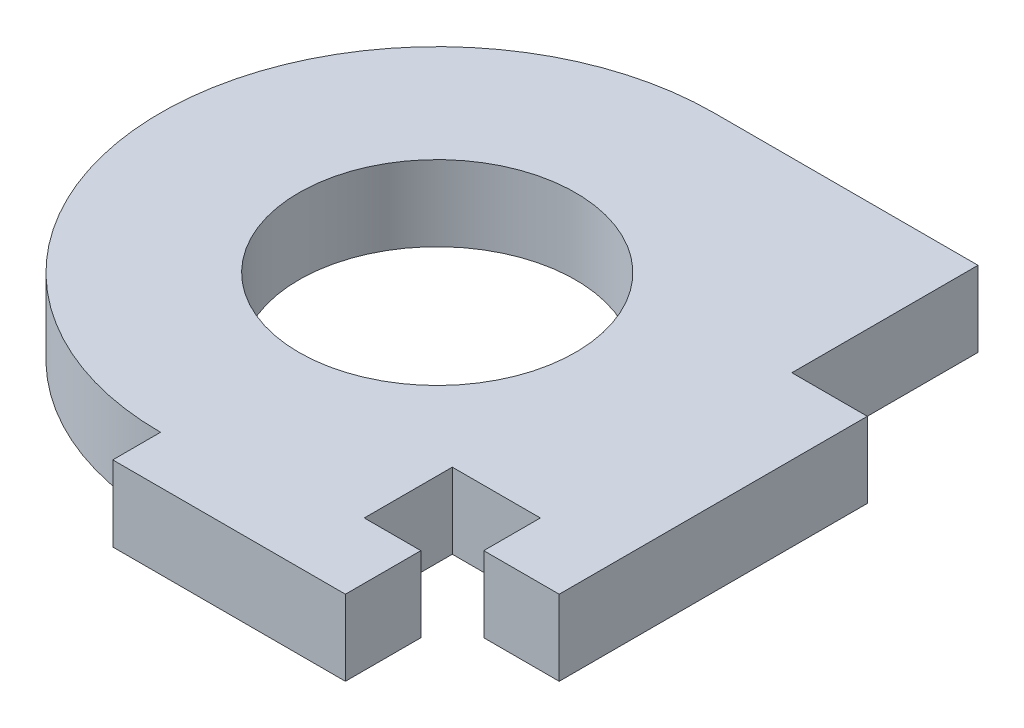
from build123d import *

# Parameters (mm, degrees)
SKETCH1_R           = 11
BOSS_EXTRUDE1_DEPTH = 6


with BuildPart() as part:
    # Sketch1 → Boss-Extrude1 (new body)
    with BuildSketch(Plane(origin=(0, 0, 0), x_dir=(1, 0, 0), z_dir=(0, 1, 0))):
        with BuildLine():
            Line((0, 0), (0, 7))
            Line((0, 7), (7, 7))
            Line((7, 7), (7, 2.5))
            Line((7, 2.5), (13, 2.5))
            Line((13, 2.5), (13, 27))
            Line((13, 27), (7, 27))
            Line((7, 27), (7, 41.8))
            Line((7, 41.8), (-14, 41.8))
            ThreePointArc((-14, 41.8), (-36, 19.8), (-14, -2.2))
            Line((-14, -2.2), (-14, -6))
            Line((-14, -6), (4.5, -6))
            Line((4.5, -6), (4.5, 0))
            Line((4.5, 0), (0, 0))
        make_face()
        with Locations(Location((-14, 19.8, 0), (0, 0, 270))):
            Circle(SKETCH1_R, mode=Mode.SUBTRACT)
    extrude(amount=BOSS_EXTRUDE1_DEPTH)


solid = part.part
